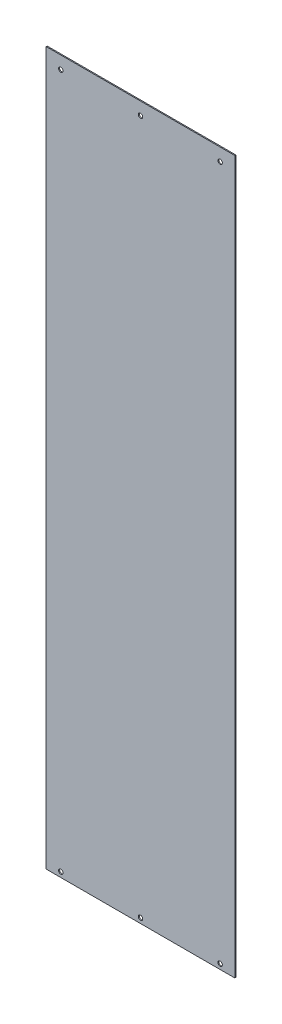
from build123d import *

# Parameters (mm, degrees)
SKETCH1_W                = 296
SKETCH1_H                = 1118
BOSS_EXTRUDE1_DEPTH      = 1.6
F_7_0_7_DIAMETER_HOLE1_D = 7
LPATTERN1_COUNT          = 2
LPATTERN1_PITCH          = 1090


with BuildPart() as part:
    # Sketch1 → Boss-Extrude1 (new body)
    with BuildSketch(Plane.XY):
        with Locations((0, 559)):
            Rectangle(SKETCH1_W, SKETCH1_H)
    extrude(amount=BOSS_EXTRUDE1_DEPTH)

    # Ø7.0 (7) Diameter Hole1 (through all)
    with Locations(Plane.XY.offset(1.6)):
        with Locations((-125, 8), (0, 8), (125, 8)):
            f_7_0_7_diameter_hole1 = Hole(F_7_0_7_DIAMETER_HOLE1_D / 2)

    # LPattern1: Ø7.0 (7) Diameter Hole1 ×2
    with Locations(*[(0, i * LPATTERN1_PITCH, 0) for i in range(1, LPATTERN1_COUNT)]):
        add(f_7_0_7_diameter_hole1, mode=Mode.SUBTRACT)


solid = part.part
